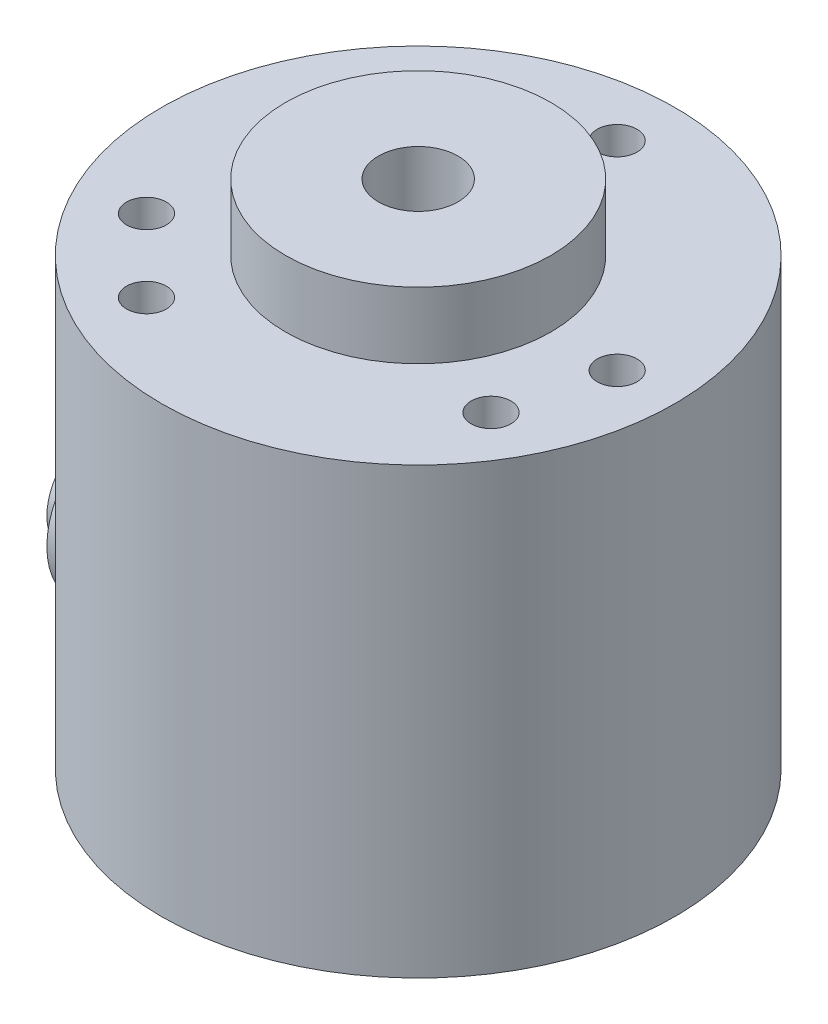
from build123d import *

# Parameters (mm, degrees)
SKETCH2_R                = 19.35
BOSS_EXTRUDE1_DEPTH      = 33.5
SKETCH3_R                = 10
BOSS_EXTRUDE2_DEPTH      = 5
SKETCH4_R                = 1.5
CUT_EXTRUDE1_DEPTH       = 3
SKETCH5_R                = 3
CUT_EXTRUDE2_DEPTH       = 6
BOSS_EXTRUDE3_REACH      = 61.72
BOSS_EXTRUDE3_END_RADIUS = 19.35
SKETCH6_R                = 6
SKETCH7_R                = 4
BOSS_EXTRUDE4_DEPTH      = 2


with BuildPart() as part:
    # Sketch2 → Boss-Extrude1 (new body)
    with BuildSketch(Plane(origin=(0, 0, 0), x_dir=(1, 0, 0), z_dir=(0, 1, 0))):
        with Locations(Location((0, 0, 0), (0, 0, 270))):
            Circle(SKETCH2_R)
    extrude(amount=BOSS_EXTRUDE1_DEPTH)

    # Sketch3 → Boss-Extrude2 (add)
    with BuildSketch(Plane(origin=(0, 33.5, 0), x_dir=(1, 0, 0), z_dir=(0, 1, 0))):
        with Locations(Location((0, 0, 0), (0, 0, 270))):
            Circle(SKETCH3_R)
    extrude(amount=BOSS_EXTRUDE2_DEPTH)

    # Sketch4 → Cut-Extrude1 (cut)
    with BuildSketch(Plane(origin=(0, 33.5, 0), x_dir=(1, 0, 0), z_dir=(0, 1, 0))):
        with Locations(Location((15, 0, 0), (0, 0, 270))):
            Circle(SKETCH4_R)
        with Locations(Location((12.990381057, -7.5, 0), (0, 0, 270))):
            Circle(SKETCH4_R)
        with Locations(Location((0, 15, 0), (0, 0, 270))):
            Circle(SKETCH4_R)
        with Locations(Location((-12.990381057, -7.5, 0), (0, 0, 270))):
            Circle(SKETCH4_R)
        with Locations(Location((-7.5, -12.990381057, 0), (0, 0, 270))):
            Circle(SKETCH4_R)
        with Locations(Location((-7.5, 12.990381057, 0), (0, 0, 270))):
            Circle(SKETCH4_R)
    extrude(amount=-CUT_EXTRUDE1_DEPTH, mode=Mode.SUBTRACT)

    # Sketch5 → Cut-Extrude2 (cut)
    with BuildSketch(Plane(origin=(0, 38.5, 0), x_dir=(1, 0, 0), z_dir=(0, 1, 0))):
        with Locations(Location((0, 0, 0), (0, 0, 270))):
            Circle(SKETCH5_R)
    extrude(amount=-CUT_EXTRUDE2_DEPTH, mode=Mode.SUBTRACT)

    # Boss-Extrude3: up to this cylinder (the profile starts outside it)
    boss_extrude3_end = Plane(origin=(0, 6.5, 0), z_dir=(0, -1, 0)) * Cylinder(BOSS_EXTRUDE3_END_RADIUS, 163.14, mode=Mode.PRIVATE)
    # Sketch6 → Boss-Extrude3 (add, up to the surface)
    with BuildSketch(Plane(origin=(-22, 0, 0), x_dir=(0, 0, -1), z_dir=(1, 0, 0)), mode=Mode.PRIVATE) as boss_extrude3_sk1:
        with Locations(Location((0, 6.5, 0), (0, 0, 180))):
            Circle(SKETCH6_R)
    boss_extrude3_tool1 = extrude(boss_extrude3_sk1.sketch, amount=BOSS_EXTRUDE3_REACH, mode=Mode.PRIVATE) - boss_extrude3_end
    add(boss_extrude3_tool1.solids().sort_by_distance((-22, 6.5, 0))[0])

    # Sketch7 → Boss-Extrude4 (add)
    with BuildSketch(Plane.ZY.offset(22)):
        with Locations((0, 6.5)):
            Circle(SKETCH7_R)
    extrude(amount=BOSS_EXTRUDE4_DEPTH)


solid = part.part
